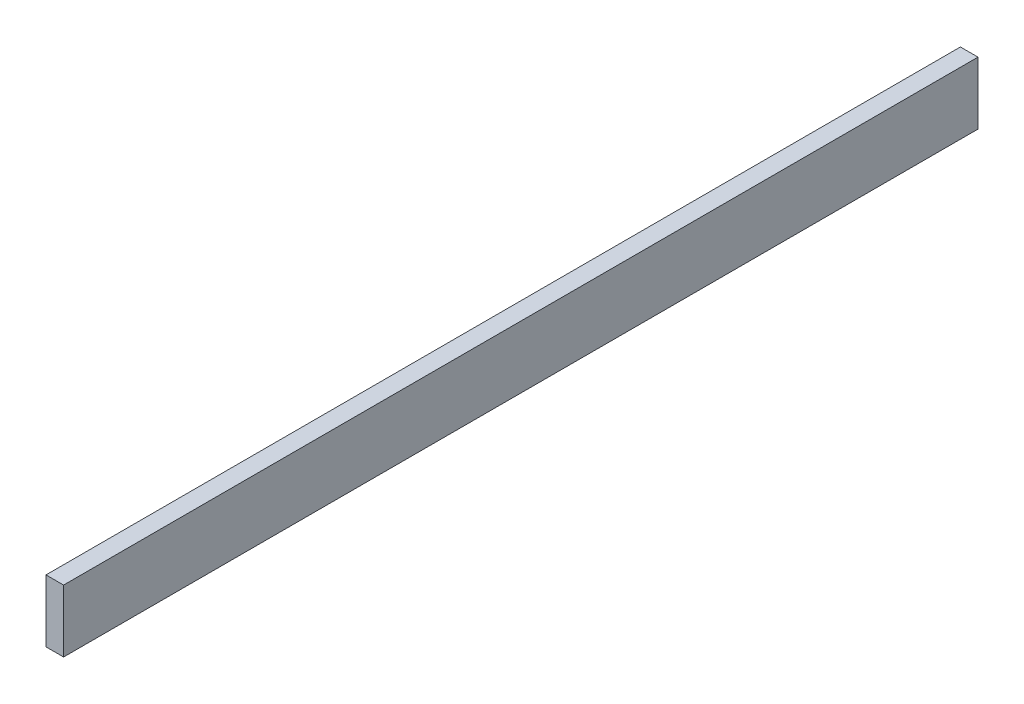
from build123d import *

# Parameters (mm, degrees)
SKETCH1_W                            = 12.7
SKETCH1_H                            = 45
CEK_DONMUS_RAY_IC_PROFIL_SOL_1_DEPTH = 660


with BuildPart() as part:
    # Sketch1 → CEK_donmus_ray_ic_profil_sol_1 (new body)
    with BuildSketch(Plane.XY):
        with Locations((6.35, 40.5)):
            Rectangle(SKETCH1_W, SKETCH1_H)
    extrude(amount=-CEK_DONMUS_RAY_IC_PROFIL_SOL_1_DEPTH)


solid = part.part
